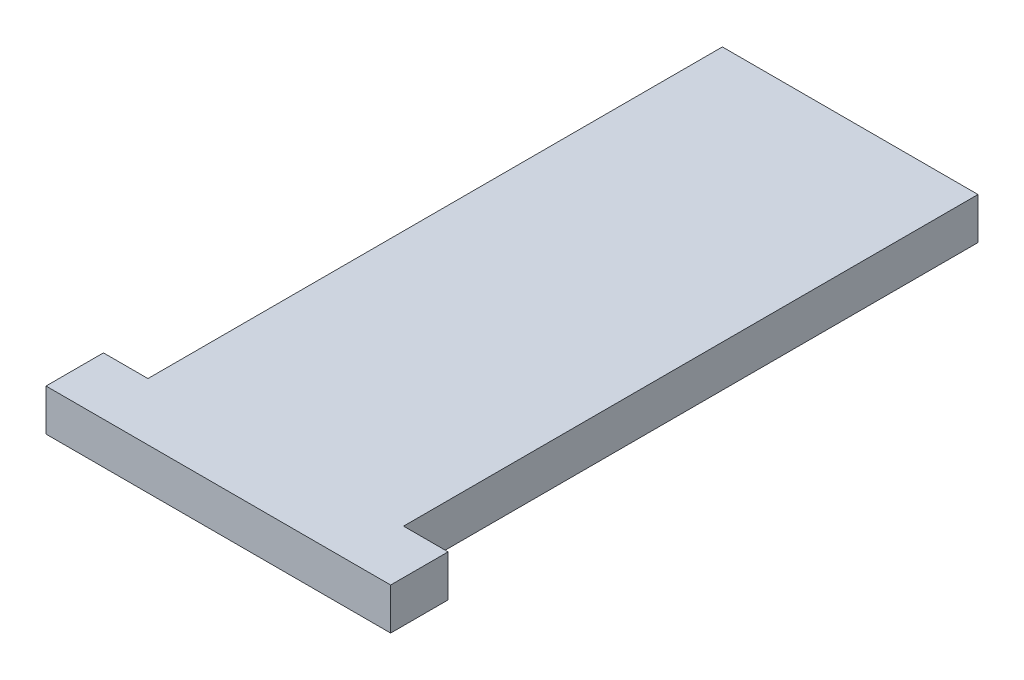
from build123d import *

# Parameters (mm, degrees)
BOSS_EXTRUDE1_DEPTH = 3.683


with BuildPart() as part:
    # Sketch1 → Boss-Extrude1 (new body)
    with BuildSketch(Plane(origin=(0, 0, 0), x_dir=(1, 0, 0), z_dir=(0, 1, 0))):
        Polygon((0, 0), (-30.48, 0), (-30.48, 5.08), (-26.543, 5.08), (-26.543, 55.88), (-3.937, 55.88), (-3.937, 5.08), (0, 5.08), align=None)
    extrude(amount=BOSS_EXTRUDE1_DEPTH)


solid = part.part
